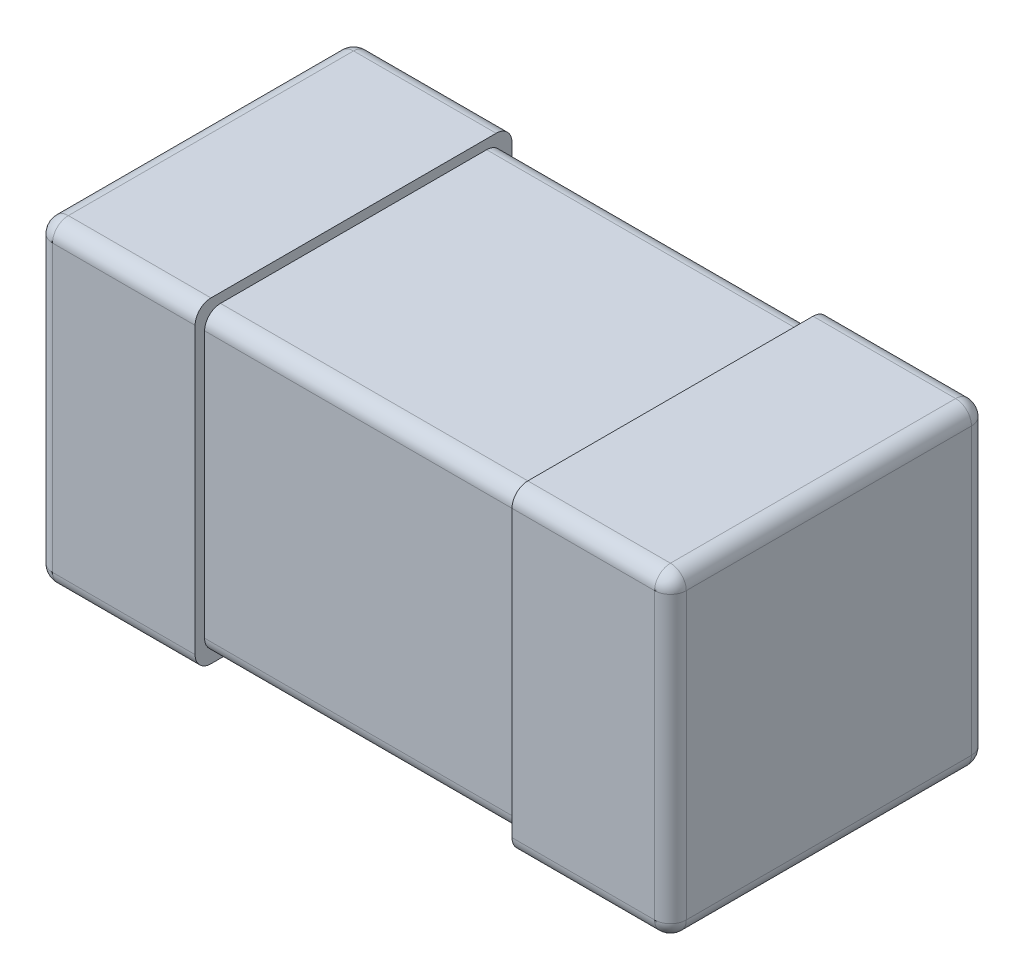
from build123d import *

# Parameters (mm, degrees)
SKETCH_3_W        = 0.25
SKETCH_3_H        = 0.5
EXTRUDE_3_DEPTH   = 0.5
EXTRUDE_3_2_DEPTH = 0.5
EXTRUDE_START     = 0.015
SKETCH_4_W        = 0.5
SKETCH_4_H        = 0.47
EXTRUDE_3_3_DEPTH = 0.47
FILLET_2_R        = 0.025
FILLET_3_R        = 0.025


with BuildPart() as part:
    # Эскиз3 → Extrude 3 (new body)
    with BuildSketch(Plane.XY):
        with Locations((0.375, 0)):
            Rectangle(SKETCH_3_W, SKETCH_3_H)
    extrude(amount=EXTRUDE_3_DEPTH)



with BuildPart() as body_2:
    # Эскиз3 → Extrude 3 2 (new body)
    with BuildSketch(Plane.XY):
        with Locations((-0.375, 0)):
            Rectangle(SKETCH_3_W, SKETCH_3_H)
    extrude(amount=EXTRUDE_3_2_DEPTH)


with BuildPart() as part_1:
    add(part.part)

    add(body_2.part)  # Extrude 3 3 merges body 2
    # Эскиз4 → Extrude 3 3 (add)
    with BuildSketch(Plane.XY.offset(EXTRUDE_START)):
        Rectangle(SKETCH_4_W, SKETCH_4_H)
    extrude(amount=EXTRUDE_3_3_DEPTH)

    # Скругление2
    fillet_2_edges = [part_1.edges().sort_by_distance(p)[0] for p in [
        (-0.5, 0, 0.5),
        (-0.375, -0.25, 0.5),
        (0.375, 0.25, 0),
        (0.5, 0.25, 0.25),
        (0.375, -0.25, 0),
        (0.5, 0, 0),
        (0.5, -0.25, 0.25),
        (0.375, 0.25, 0.5),
        (0.375, -0.25, 0.5),
        (0.5, 0, 0.5),
        (-0.375, -0.25, 0),
        (-0.5, 0, 0),
        (-0.375, 0.25, 0),
        (-0.375, 0.25, 0.5),
        (-0.5, -0.25, 0.25),
        (-0.5, 0.25, 0.25),
    ]]
    fillet(fillet_2_edges, radius=FILLET_2_R)

    # Скругление3
    fillet_3_edges = [part_1.edges().sort_by_distance(p)[0] for p in [
        (0, -0.235, 0.015),
        (0, 0.235, 0.015),
        (0, 0.235, 0.485),
        (0, -0.235, 0.485),
    ]]
    fillet(fillet_3_edges, radius=FILLET_3_R)


solid = part_1.part
